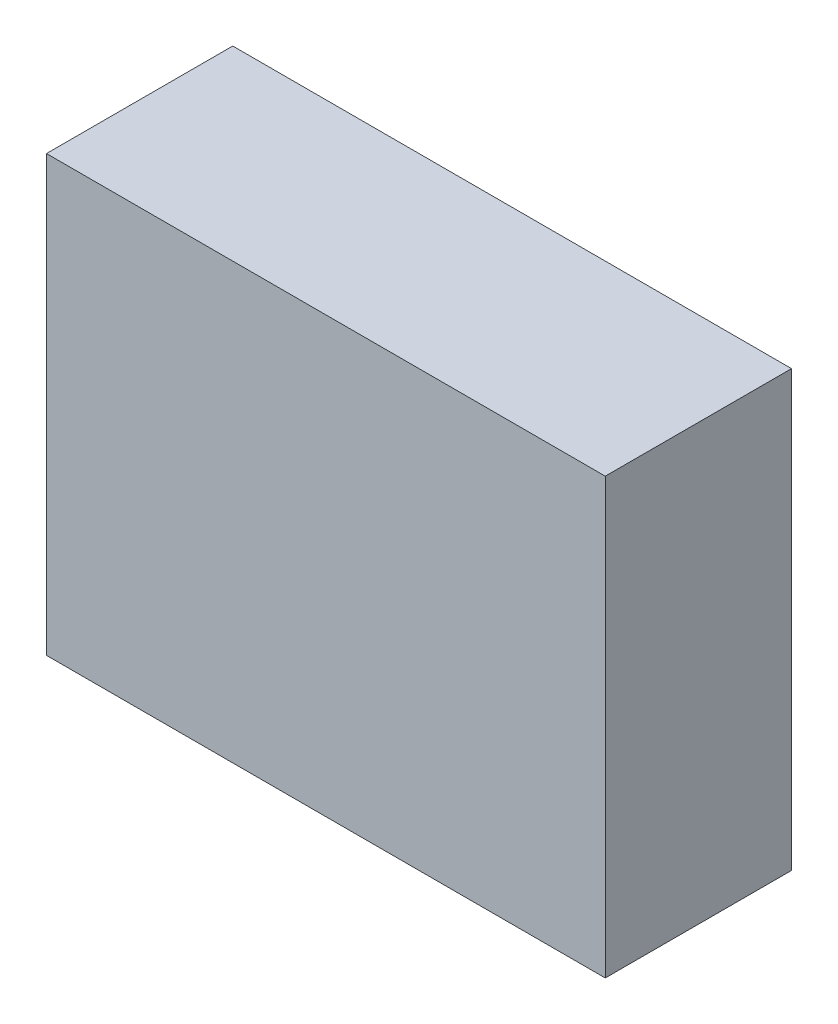
from build123d import *

# Parameters (mm, degrees)
SKETCH1_W           = 900
SKETCH1_H           = 700
BOSS_EXTRUDE1_DEPTH = 300
SHELL1_T            = 10


with BuildPart() as part:
    # Sketch1 → Boss-Extrude1 (new body)
    with BuildSketch(Plane.XY):
        with Locations((450, 350)):
            Rectangle(SKETCH1_W, SKETCH1_H)
    extrude(amount=BOSS_EXTRUDE1_DEPTH)

    # Shell1 (no face opened: a closed hollow body)
    add(offset(amount=-SHELL1_T, mode=Mode.PRIVATE), mode=Mode.SUBTRACT)


solid = part.part
